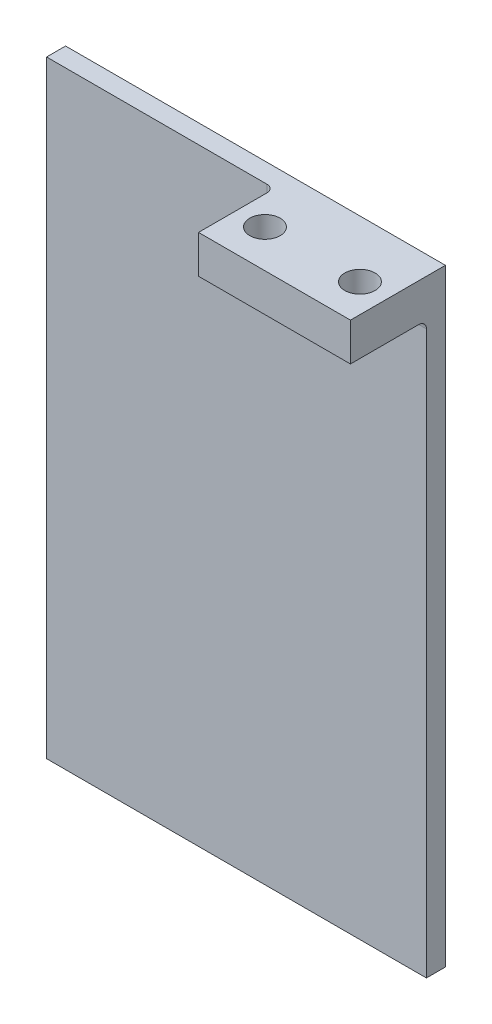
from build123d import *

# Parameters (mm, degrees)
SKETCH_1_W          = 100
SKETCH_1_H          = 160
EXTRUDE_1_DEPTH     = 5
SKETCH_2_W          = 40
SKETCH_2_H          = 20
EXTRUDE_2_DEPTH     = 10
SKETCH_3_R          = 4
CUT_EXTRUDE_1_DEPTH = 10
FILLET_1_R          = 2


with BuildPart() as part:
    # 草图1 → 凸台-拉伸1 (new body)
    with BuildSketch(Plane.XY):
        Rectangle(SKETCH_1_W, SKETCH_1_H)
    extrude(amount=EXTRUDE_1_DEPTH)

    # 草图2 → 凸台-拉伸2 (add)
    with BuildSketch(Plane(origin=(0, 80, 0), x_dir=(1, 0, 0), z_dir=(0, 1, 0))):
        with Locations((30, -15)):
            Rectangle(SKETCH_2_W, SKETCH_2_H)
    extrude(amount=-EXTRUDE_2_DEPTH)

    # 草图3 → 切除-拉伸1 (cut)
    with BuildSketch(Plane.XZ.offset(-70)):
        with Locations(Location((17.5, 15, 0), (0, 0, 270))):
            Circle(SKETCH_3_R)
        with Locations(Location((42.5, 15, 0), (0, 0, 270))):
            Circle(SKETCH_3_R)
    extrude(amount=-CUT_EXTRUDE_1_DEPTH, mode=Mode.SUBTRACT)

    # 圆角1
    fillet_1_edges = [part.edges().sort_by_distance(p)[0] for p in [
        (30, 70, 5),
        (10, 75, 5),
    ]]
    fillet(fillet_1_edges, radius=FILLET_1_R)


solid = part.part
